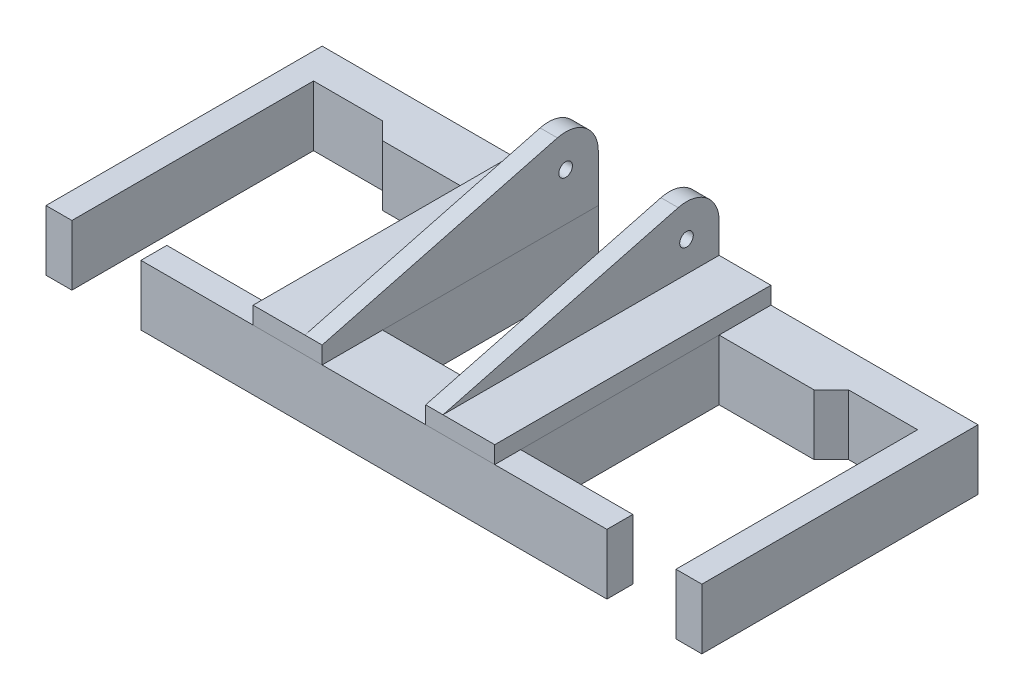
from build123d import *

# Parameters (mm, degrees)
BOSS_EXTRUDE1_DEPTH     = 22.225
BOSS_EXTRUDE2_DEPTH     = 101.6
BOSS_EXTRUDE2_2_DEPTH   = 101.6
CUT_EXTRUDE2_DEPTH      = 174.814939303
CUT_EXTRUDE2_DEPTH_BACK = 174.814939303
SKETCH6_R               = 2.5


with BuildPart() as part:
    # Sketch1 → Boss-Extrude1 (new body)
    with BuildSketch(Plane(origin=(0, 0, 0), x_dir=(1, 0, 0), z_dir=(0, 1, 0))):
        Polygon((-19.05, 0), (-19.05, -79.375), (19.05, -79.375), (19.05, 0), (120.65, 0), (120.65, -101.6), (111.125, -101.6), (111.125, -12.7), (85.725, -12.7), (79.375, -19.05), (44.45, -19.05), (44.45, -92.075), (85.725, -92.075), (85.725, -101.6), (-85.725, -101.6), (-85.725, -92.075), (-44.45, -92.075), (-44.45, -19.05), (-79.375, -19.05), (-85.725, -12.7), (-111.125, -12.7), (-111.125, -101.6), (-120.65, -101.6), (-120.65, 0), align=None)
    extrude(amount=BOSS_EXTRUDE1_DEPTH)


with BuildPart() as body_2:
    # Sketch5 → Boss-Extrude2 (new body)
    with BuildSketch(Plane(origin=(0, 0, 0), x_dir=(-1, 0, 0), z_dir=(0, 0, -1))):
        Polygon((-19.05, 22.225), (-19.05, 73.025), (-25.4, 73.025), (-25.4, 28.575), (-44.45, 28.575), (-44.45, 22.225), align=None)
    extrude(amount=-BOSS_EXTRUDE2_DEPTH)


with BuildPart() as body_3:
    # Sketch5 → Boss-Extrude2 2 (new body)
    with BuildSketch(Plane(origin=(0, 0, 0), x_dir=(-1, 0, 0), z_dir=(0, 0, -1))):
        Polygon((19.05, 22.225), (44.45, 22.225), (44.45, 28.575), (25.4, 28.575), (25.4, 73.025), (19.05, 73.025), align=None)
    extrude(amount=-BOSS_EXTRUDE2_2_DEPTH)


with BuildPart() as cut_extrude2_tool:
    # Sketch6 → Cut-Extrude2 (new, two sides: drawn at the far end of the back side and taken through both)
    with BuildSketch(Plane(origin=(0, 0, 0), x_dir=(0, 0, -1), z_dir=(1, 0, 0)).offset(-CUT_EXTRUDE2_DEPTH_BACK)):
        with Locations((-12, 39.6875)):
            Circle(SKETCH6_R)
        with BuildLine():
            Line((-101.6, 28.575), (-15.046658445, 51.294302847))
            ThreePointArc((-15.046658445, 51.294302847), (-4.670603754, 49.18907622), (0, 39.6875))
            Line((0, 39.6875), (13.396448298, 39.6875))
            Line((13.396448298, 39.6875), (13.396448298, 119.690171167))
            Line((13.396448298, 119.690171167), (-183.880058166, 119.690171167))
            Line((-183.880058166, 119.690171167), (-101.6, 28.575))
        make_face()
    extrude(amount=CUT_EXTRUDE2_DEPTH + CUT_EXTRUDE2_DEPTH_BACK)


with BuildPart() as body_2_1:
    add(body_2.part)

    # Cut-Extrude2: cut by cut_extrude2_tool
    add(cut_extrude2_tool.part, mode=Mode.SUBTRACT)


with BuildPart() as body_3_1:
    add(body_3.part)

    # Cut-Extrude2: cut by cut_extrude2_tool
    add(cut_extrude2_tool.part, mode=Mode.SUBTRACT)


solid = Compound([part.part, body_2_1.part, body_3_1.part])
